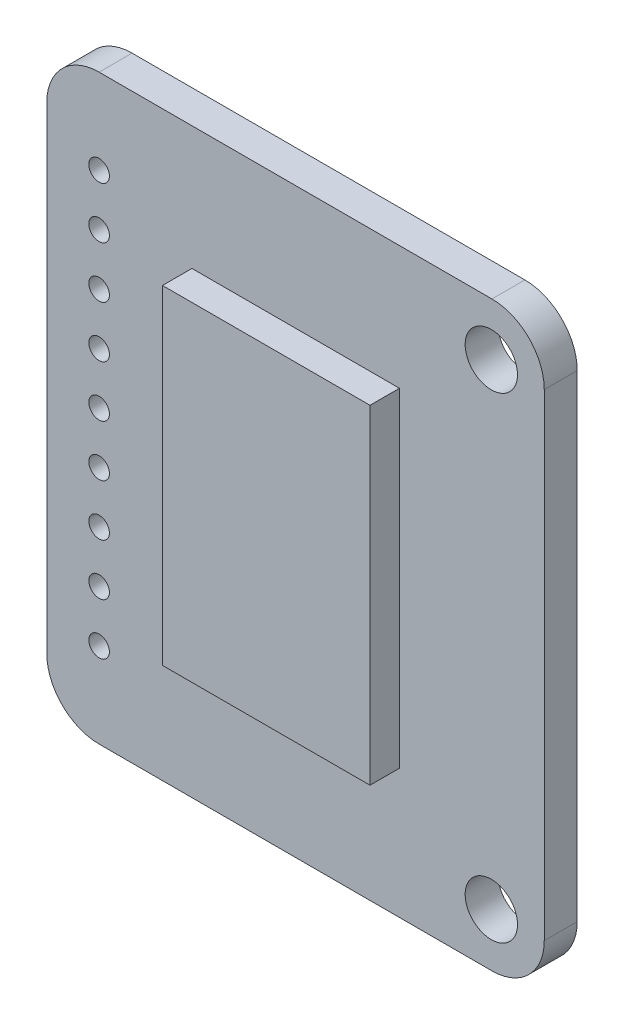
from build123d import *

# Parameters (mm, degrees)
SKETCH1_W           = 24.15
SKETCH1_H           = 28.25
BOSS_EXTRUDE1_DEPTH = 1.6
SKETCH2_R           = 1.27
CUT_EXTRUDE1_DEPTH  = 19.651575001
FILLET1_R           = 2.54
SKETCH3_R           = 0.5
CUT_EXTRUDE2_DEPTH  = 19.651575001
LPATTERN1_COUNT     = 5
LPATTERN1_PITCH     = 2.5
LPATTERN1_COL_COUNT = 5
LPATTERN1_COL_PITCH = 2.5
SKETCH4_W           = 10.07376305
SKETCH4_H           = 15.97396984
BOSS_EXTRUDE2_DEPTH = 1.43


with BuildPart() as part:
    # Sketch1 → Boss-Extrude1 (new body)
    with BuildSketch(Plane.XY):
        Rectangle(SKETCH1_W, SKETCH1_H)
    extrude(amount=BOSS_EXTRUDE1_DEPTH)

    # Sketch2 → Cut-Extrude1 (cut, through all)
    with BuildSketch(Plane.XY.offset(1.6)):
        with Locations((9.505, 11.557)):
            Circle(SKETCH2_R)
        with Locations((9.505, -11.557)):
            Circle(SKETCH2_R)
    extrude(amount=-CUT_EXTRUDE1_DEPTH, mode=Mode.SUBTRACT)

    # Fillet1
    fillet1_edges = [part.edges().sort_by_distance(p)[0] for p in [
        (12.075, -14.125, 0.8),
        (-12.075, -14.125, 0.8),
        (-12.075, 14.125, 0.8),
        (12.075, 14.125, 0.8),
    ]]
    fillet(fillet1_edges, radius=FILLET1_R)

    # Sketch3 → Cut-Extrude2 (cut, through all)
    with BuildSketch(Plane.XY.offset(1.6)):
        with Locations((-9.535, 0)):
            Circle(SKETCH3_R)
    cut_extrude2 = extrude(amount=-CUT_EXTRUDE2_DEPTH, mode=Mode.SUBTRACT)

    # LPattern1: Cut-Extrude2 ×5
    with Locations(*[(0, -i * LPATTERN1_PITCH, 0) for i in range(1, LPATTERN1_COUNT)]):
        add(cut_extrude2, mode=Mode.SUBTRACT)

    # LPattern1 col: Cut-Extrude2 ×5
    with Locations(*[(0, i * LPATTERN1_COL_PITCH, 0) for i in range(1, LPATTERN1_COL_COUNT)]):
        add(cut_extrude2, mode=Mode.SUBTRACT)

    # Sketch4 → Boss-Extrude2 (add)
    with BuildSketch(Plane.XY.offset(1.6)):
        with Locations((0.008744266, 0.138172191)):
            Rectangle(SKETCH4_W, SKETCH4_H)
    extrude(amount=BOSS_EXTRUDE2_DEPTH)


solid = part.part
